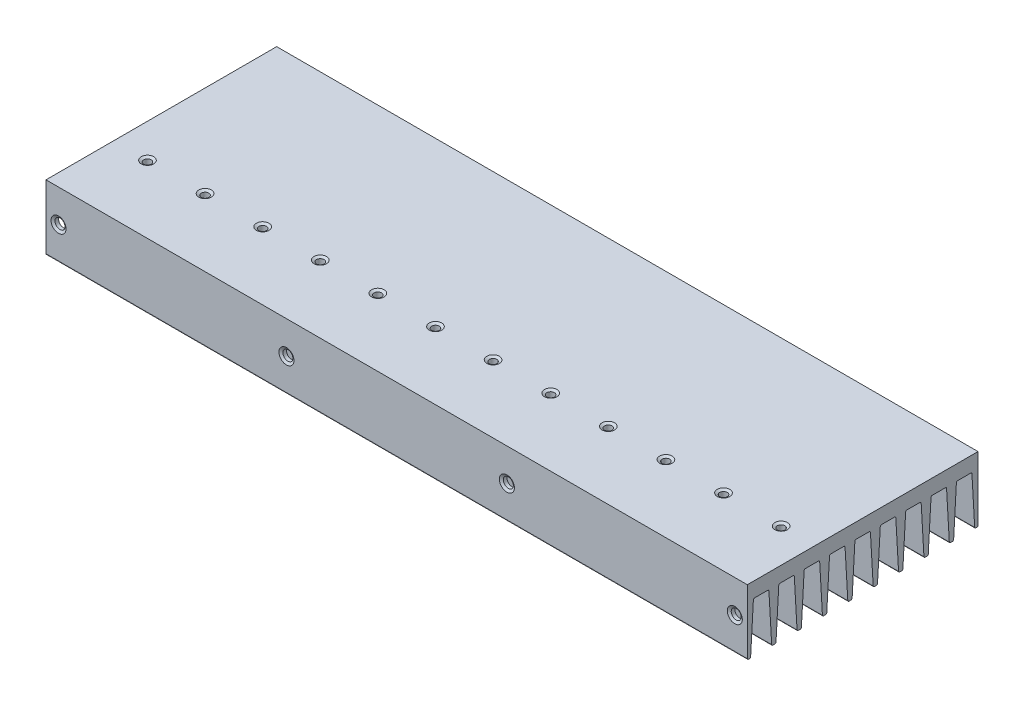
from build123d import *

# Parameters (mm, degrees)
BOSS_EXTRUDE1_DEPTH = 140
FILLET1_R           = 0.5
SKETCH2_R           = 1.5
CUT_EXTRUDE1_DEPTH  = 20
CHAMFER1_SIZE       = 1
CHAMFER1_SIZE2      = 0.577350269
SKETCH3_R           = 2
CUT_EXTRUDE2_DEPTH  = 5
CHAMFER2_SIZE       = 1
CHAMFER2_SIZE2      = 0.577350269


with BuildPart() as part:
    # Sketch1 → Boss-Extrude1 (new, symmetric)
    with BuildSketch(Plane(origin=(0, 0, 0), x_dir=(0, 0, -1), z_dir=(1, 0, 0))):
        Polygon((-44.75, -13), (-43.6, 7), (-37.45, 7), (-36.3, -13), (-34.61875, -13), (-33.46875, 7), (-27.31875, 7), (-26.16875, -13), (-24.4875, -13), (-23.3375, 7), (-17.1875, 7), (-16.0375, -13), (-14.35625, -13), (-13.20625, 7), (-7.05625, 7), (-5.90625, -13), (-4.225, -13), (-3.075, 7), (3.075, 7), (4.225, -13), (5.90625, -13), (7.05625, 7), (13.20625, 7), (14.35625, -13), (16.0375, -13), (17.1875, 7), (23.3375, 7), (24.4875, -13), (26.16875, -13), (27.31875, 7), (33.46875, 7), (34.61875, -13), (36.3, -13), (37.45, 7), (43.6, 7), (44.75, -13), (46.05, -13), (46.05, 13), (-46.05, 13), (-46.05, -13), align=None)
    extrude(amount=BOSS_EXTRUDE1_DEPTH, both=True)

    # Fillet1
    fillet1_edges = [part.edges().sort_by_distance(p)[0] for p in [
        (0, -13, -44.75),
        (0, 7, -43.6),
        (0, 7, -37.45),
        (0, -13, -36.3),
        (0, -13, -34.61875),
        (0, 7, -33.46875),
        (0, 7, -27.31875),
        (0, -13, -26.16875),
        (0, -13, -24.4875),
        (0, 7, -23.3375),
        (0, 7, -17.1875),
        (0, -13, -16.0375),
        (0, -13, -14.35625),
        (0, 7, -13.20625),
        (0, 7, -7.05625),
        (0, -13, -5.90625),
        (0, -13, -4.225),
        (0, 7, -3.075),
        (0, 7, 3.075),
        (0, -13, 4.225),
        (0, -13, 5.90625),
        (0, 7, 7.05625),
        (0, 7, 13.20625),
        (0, -13, 14.35625),
        (0, -13, 16.0375),
        (0, 7, 17.1875),
        (0, 7, 23.3375),
        (0, -13, 24.4875),
        (0, -13, 26.16875),
        (0, 7, 27.31875),
        (0, 7, 33.46875),
        (0, -13, 34.61875),
        (0, -13, 36.3),
        (0, 7, 37.45),
        (0, 7, 43.6),
        (0, -13, 44.75),
        (0, -13, 46.05),
        (0, -13, -46.05),
    ]]
    fillet(fillet1_edges, radius=FILLET1_R)

    # Sketch2 → Cut-Extrude1 (cut)
    with BuildSketch(Plane(origin=(0, 13, 0), x_dir=(1, 0, 0), z_dir=(0, 1, 0))):
        with Locations(Location((126.5, -19.05, 0), (0, 0, 270))):
            Circle(SKETCH2_R)
        with Locations(Location((103.5, -19.05, 0), (0, 0, 270))):
            Circle(SKETCH2_R)
        with Locations(Location((80.5, -19.05, 0), (0, 0, 270))):
            Circle(SKETCH2_R)
        with Locations(Location((57.5, -19.05, 0), (0, 0, 270))):
            Circle(SKETCH2_R)
        with Locations(Location((34.5, -19.05, 0), (0, 0, 270))):
            Circle(SKETCH2_R)
        with Locations(Location((11.5, -19.05, 0), (0, 0, 270))):
            Circle(SKETCH2_R)
        with Locations(Location((-11.5, -19.05, 0), (0, 0, 270))):
            Circle(SKETCH2_R)
        with Locations(Location((-34.5, -19.05, 0), (0, 0, 270))):
            Circle(SKETCH2_R)
        with Locations(Location((-57.5, -19.05, 0), (0, 0, 270))):
            Circle(SKETCH2_R)
        with Locations(Location((-80.5, -19.05, 0), (0, 0, 270))):
            Circle(SKETCH2_R)
        with Locations(Location((-103.5, -19.05, 0), (0, 0, 270))):
            Circle(SKETCH2_R)
        with Locations(Location((-126.5, -19.05, 0), (0, 0, 270))):
            Circle(SKETCH2_R)
    extrude(amount=-CUT_EXTRUDE1_DEPTH, mode=Mode.SUBTRACT)

    # Chamfer1
    chamfer1_edges = [part.edges().sort_by_distance(p)[0] for p in [
        (126.5, 13, 17.55),
        (103.5, 13, 17.55),
        (80.5, 13, 17.55),
        (57.5, 13, 17.55),
        (34.5, 13, 17.55),
        (11.5, 13, 17.55),
        (-11.5, 13, 17.55),
        (-34.5, 13, 17.55),
        (-57.5, 13, 17.55),
        (-80.5, 13, 17.55),
        (-103.5, 13, 17.55),
        (-126.5, 13, 17.55),
    ]]
    chamfer1_side = [part.faces().sort_by_distance(p)[0] for p in [
        (0, 13, -0.062866866),
    ]]
    chamfer(chamfer1_edges, length=CHAMFER1_SIZE, length2=CHAMFER1_SIZE2, reference=chamfer1_side[0])

    # Sketch3 → Cut-Extrude2 (cut)
    with BuildSketch(Plane.XY.offset(46.05)):
        with Locations((-135, 0)):
            Circle(SKETCH3_R)
        with Locations((-44, 0)):
            Circle(SKETCH3_R)
        with Locations(Location((44, 0, 0), (0, 0, 270))):
            Circle(SKETCH3_R)
        with Locations(Location((135, 0, 0), (0, 0, 270))):
            Circle(SKETCH3_R)
    extrude(amount=-CUT_EXTRUDE2_DEPTH, mode=Mode.SUBTRACT)

    # Chamfer2
    chamfer2_edges = [part.edges().sort_by_distance(p)[0] for p in [
        (-137, 0, 46.05),
        (-46, 0, 46.05),
        (44, 2, 46.05),
        (135, 2, 46.05),
    ]]
    chamfer2_side = [part.faces().sort_by_distance(p)[0] for p in [
        (0, 0.251772474, 46.05),
    ]]
    chamfer(chamfer2_edges, length=CHAMFER2_SIZE, length2=CHAMFER2_SIZE2, reference=chamfer2_side[0])


solid = part.part
